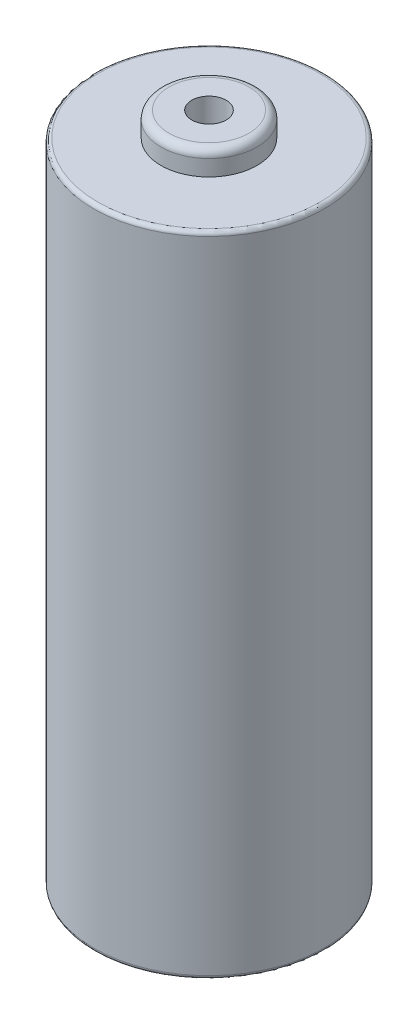
from build123d import *

# Parameters (mm, degrees)
SKETCH1_R           = 3.6576
BOSS_EXTRUDE1_DEPTH = 10.287
FILLET1_R           = 0.127
SKETCH2_R           = 1.524
BOSS_EXTRUDE2_DEPTH = 0.762
FILLET2_R           = 0.254
SKETCH3_R           = 0.5461
CUT_EXTRUDE1_DEPTH  = 10.16


with BuildPart() as part:
    # Sketch1 → Boss-Extrude1 (new, symmetric)
    with BuildSketch(Plane(origin=(0, 0, 0), x_dir=(1, 0, 0), z_dir=(0, 1, 0))):
        with Locations(Location((0, 0, 0), (0, 0, 270))):
            Circle(SKETCH1_R)
    extrude(amount=BOSS_EXTRUDE1_DEPTH, both=True)

    # Fillet1
    fillet1_edges = [part.edges().sort_by_distance(p)[0] for p in [
        (0, -10.287, -3.6576),
        (0, 10.287, -3.6576),
    ]]
    fillet(fillet1_edges, radius=FILLET1_R)

    # Sketch2 → Boss-Extrude2 (add)
    with BuildSketch(Plane(origin=(0, 10.287, 0), x_dir=(1, 0, 0), z_dir=(0, 1, 0))):
        with Locations(Location((0, 0, 0), (0, 0, 90))):
            Circle(SKETCH2_R)
    extrude(amount=BOSS_EXTRUDE2_DEPTH)

    # Fillet2
    fillet2_edges = [part.edges().sort_by_distance(p)[0] for p in [
        (0, 11.049, 1.524),
    ]]
    fillet(fillet2_edges, radius=FILLET2_R)

    # Sketch3 → Cut-Extrude1 (cut)
    with BuildSketch(Plane(origin=(0, 11.049, 0), x_dir=(1, 0, 0), z_dir=(0, 1, 0))):
        with Locations(Location((0, 0, 0), (0, 0, 270))):
            Circle(SKETCH3_R)
    extrude(amount=-CUT_EXTRUDE1_DEPTH, mode=Mode.SUBTRACT)


solid = part.part
